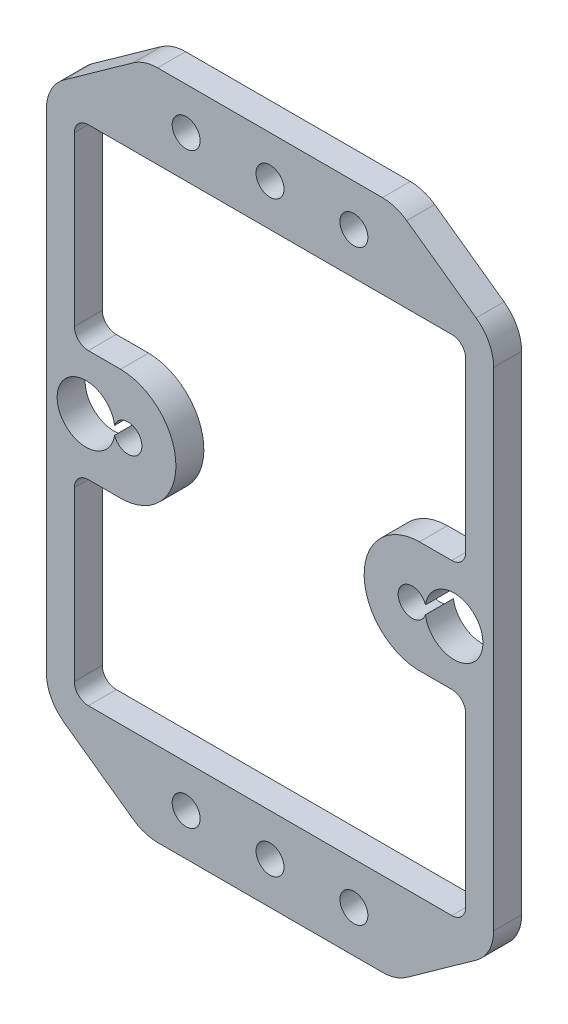
from build123d import *

# Parameters (mm, degrees)
MODEL_R                 = 1.5
SALIENTE_EXTRUIR1_DEPTH = 3


with BuildPart() as part:
    # Model → Saliente-Extruir1 (new body)
    with BuildSketch(Plane.XY):
        with BuildLine():
            ThreePointArc((59.248437734, 226.067919021), (60.634120255, 227.670602527), (61.132865862, 229.729719641))
            Line((61.132865862, 229.729719641), (61.132865862, 282.097548174))
            ThreePointArc((61.132865862, 282.097548174), (60.634120255, 284.156665288), (59.248437734, 285.759348794))
            Line((59.248437734, 285.759348794), (51.806344994, 291.075129323))
            ThreePointArc((51.806344994, 291.075129323), (50.564071562, 291.698658491), (49.190773122, 291.913328703))
            Line((49.190773122, 291.913328703), (25.074958603, 291.913328703))
            ThreePointArc((25.074958603, 291.913328703), (23.701660163, 291.698658491), (22.459386731, 291.075129323))
            Line((22.459386731, 291.075129323), (15.017293991, 285.759348794))
            ThreePointArc((15.017293991, 285.759348794), (13.63161147, 284.156665288), (13.132865862, 282.097548174))
            Line((13.132865862, 282.097548174), (13.132865862, 229.729719641))
            ThreePointArc((13.132865862, 229.729719641), (13.63161147, 227.670602527), (15.017293991, 226.067919021))
            Line((15.017293991, 226.067919021), (22.459386731, 220.752138492))
            ThreePointArc((22.459386731, 220.752138492), (23.701660163, 220.128609324), (25.074958603, 219.913939113))
            Line((25.074958603, 219.913939113), (49.190773122, 219.913939113))
            ThreePointArc((49.190773122, 219.913939113), (50.564071562, 220.128609324), (51.806344994, 220.752138492))
            Line((51.806344994, 220.752138492), (59.248437734, 226.067919021))
        make_face()
        with Locations((28.132865862, 224.413939113)):
            Circle(MODEL_R, mode=Mode.SUBTRACT)
        with BuildLine():
            ThreePointArc((20.454104838, 256.369594574), (23.38312543, 255.913735735), (20.454166764, 255.457479185))
            ThreePointArc((20.454166764, 255.457479185), (14.28786587, 255.913118236), (20.454104838, 256.369594574))
        make_face(mode=Mode.SUBTRACT)
        with Locations((37.132865862, 224.413939113)):
            Circle(MODEL_R, mode=Mode.SUBTRACT)
        with Locations((46.132865862, 224.413939113)):
            Circle(MODEL_R, mode=Mode.SUBTRACT)
        with BuildLine():
            ThreePointArc((53.811907003, 255.45692477), (50.883125437, 255.913735745), (53.81196901, 256.370148994))
            ThreePointArc((53.81196901, 256.370148994), (59.978125426, 255.913118206), (53.811907003, 255.45692477))
        make_face(mode=Mode.SUBTRACT)
        with Locations((28.132865862, 287.413939112)):
            Circle(MODEL_R, mode=Mode.SUBTRACT)
        with BuildLine():
            Line((16.132865862, 263.413328703), (16.132865862, 281.413328703))
            ThreePointArc((16.132865862, 281.413328703), (16.572205691, 282.473988875), (17.632865862, 282.913328703))
            Line((17.632865862, 282.913328703), (56.632865862, 282.913328703))
            ThreePointArc((56.632865862, 282.913328703), (57.693526034, 282.473988875), (58.132865862, 281.413328703))
            Line((58.132865862, 281.413328703), (58.132865862, 263.413328703))
            ThreePointArc((58.132865862, 263.413328703), (57.693526034, 262.352668531), (56.632865862, 261.913328703))
            Line((56.632865862, 261.913328703), (53.293383336, 261.913328703))
            Line((53.293383336, 261.913328703), (53.172348389, 261.913328703))
            ThreePointArc((53.172348389, 261.913328703), (47.235274136, 256.083614768), (52.832637551, 249.926997348))
            Line((52.832637551, 249.926997348), (56.632865862, 249.926997348))
            ThreePointArc((56.632865862, 249.926997348), (57.693526034, 249.48765752), (58.132865862, 248.426997348))
            Line((58.132865862, 248.426997348), (58.132865862, 230.413939113))
            ThreePointArc((58.132865862, 230.413939113), (57.693526034, 229.353278941), (56.632865862, 228.913939113))
            Line((56.632865862, 228.913939113), (17.632865862, 228.913939113))
            ThreePointArc((17.632865862, 228.913939113), (16.572205691, 229.353278941), (16.132865862, 230.413939113))
            Line((16.132865862, 230.413939113), (16.132865862, 248.426997348))
            ThreePointArc((16.132865862, 248.426997348), (16.572205691, 249.48765752), (17.632865862, 249.926997348))
            Line((17.632865862, 249.926997348), (21.433094174, 249.926997348))
            ThreePointArc((21.433094174, 249.926997348), (27.030457589, 256.083614768), (21.093383336, 261.913328703))
            Line((21.093383336, 261.913328703), (20.972348389, 261.913328703))
            Line((20.972348389, 261.913328703), (17.632865862, 261.913328703))
            ThreePointArc((17.632865862, 261.913328703), (16.572205691, 262.352668531), (16.132865862, 263.413328703))
        make_face(mode=Mode.SUBTRACT)
        with Locations((37.132865862, 287.413939112)):
            Circle(MODEL_R, mode=Mode.SUBTRACT)
        with Locations((46.132865862, 287.413939112)):
            Circle(MODEL_R, mode=Mode.SUBTRACT)
    extrude(amount=SALIENTE_EXTRUIR1_DEPTH)


solid = part.part
